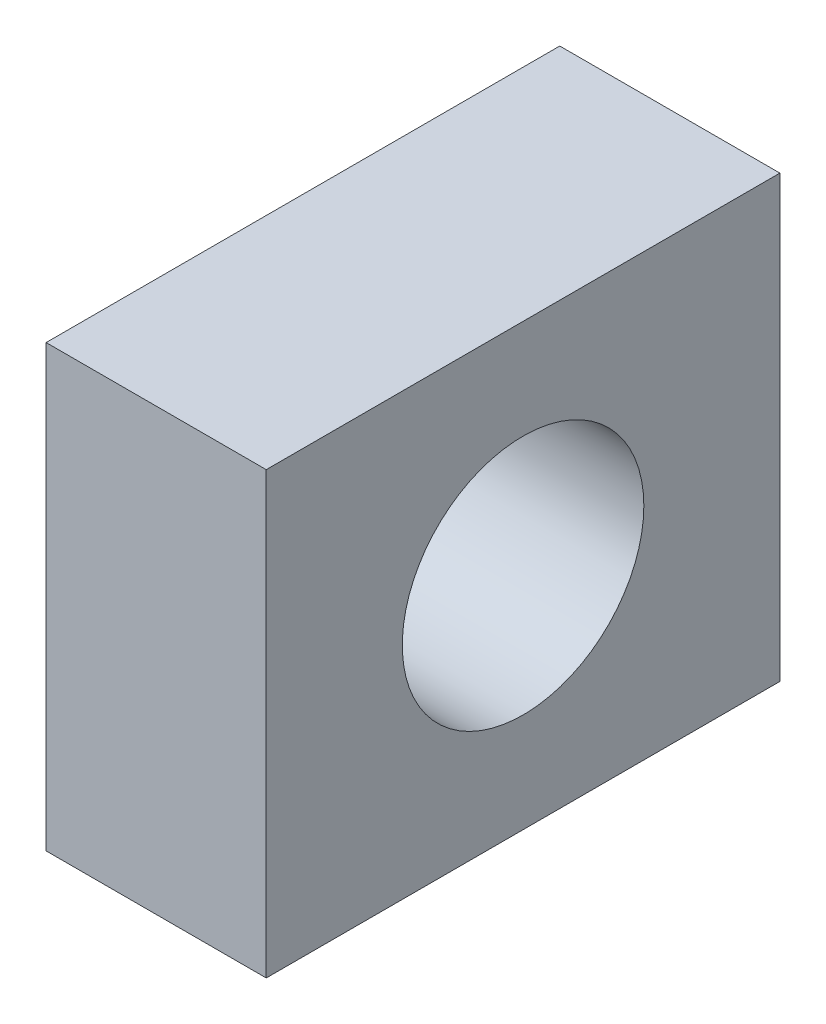
from build123d import *

# Parameters (mm, degrees)
SKETCH1_W           = 35
SKETCH1_H           = 30
BOSS_EXTRUDE1_DEPTH = 25
SKETCH2_R           = 8.23
CUT_EXTRUDE1_DEPTH  = 51
SKETCH3_W           = 35
SKETCH3_H           = 30
CUT_EXTRUDE2_DEPTH  = 5
SKETCH4_W           = 35
SKETCH4_H           = 30
CUT_EXTRUDE3_DEPTH  = 5


with BuildPart() as part:
    # Sketch1 → Boss-Extrude1 (new body)
    with BuildSketch(Plane(origin=(0, 0, 0), x_dir=(0, 0, -1), z_dir=(1, 0, 0))):
        Rectangle(SKETCH1_W, SKETCH1_H)
    extrude(amount=BOSS_EXTRUDE1_DEPTH)

    # Sketch2 → Cut-Extrude1 (cut)
    with BuildSketch(Plane(origin=(25, 0, 0), x_dir=(0, 0, -1), z_dir=(1, 0, 0))):
        Circle(SKETCH2_R)
    extrude(amount=-CUT_EXTRUDE1_DEPTH, mode=Mode.SUBTRACT)

    # Sketch3 → Cut-Extrude2 (cut)
    with BuildSketch(Plane(origin=(25, 0, 0), x_dir=(0, 0, -1), z_dir=(1, 0, 0))):
        Rectangle(SKETCH3_W, SKETCH3_H)
    extrude(amount=-CUT_EXTRUDE2_DEPTH, mode=Mode.SUBTRACT)

    # Sketch4 → Cut-Extrude3 (cut)
    with BuildSketch(Plane(origin=(20, 0, 0), x_dir=(0, 0, -1), z_dir=(1, 0, 0))):
        Rectangle(SKETCH4_W, SKETCH4_H)
    extrude(amount=-CUT_EXTRUDE3_DEPTH, mode=Mode.SUBTRACT)


solid = part.part
